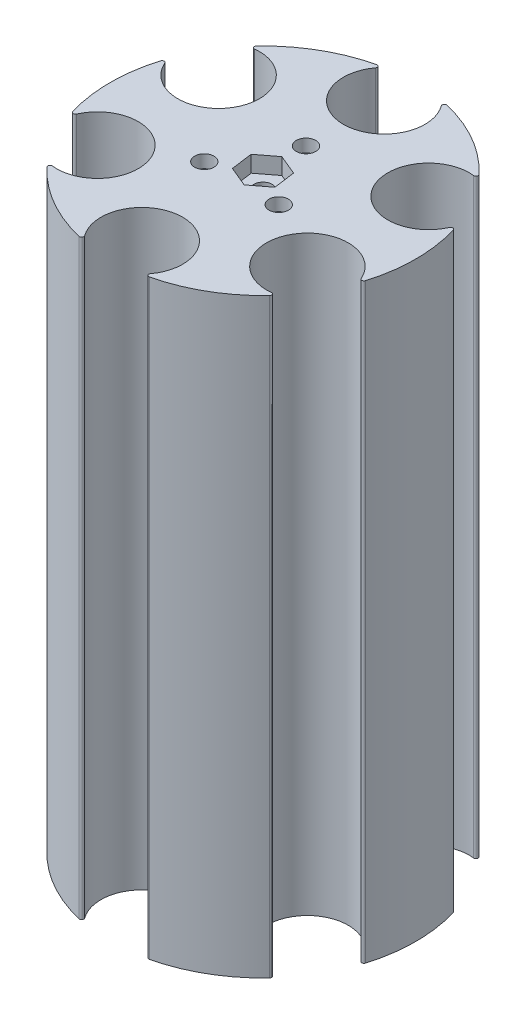
from build123d import *

# Parameters (mm, degrees)
SKETCH1_R               = 35.56
BOSS_EXTRUDE1_DEPTH     = 68.75
SKETCH2_R               = 9.5
CUT_EXTRUDE1_DEPTH      = 147.407913721
CIRPATTERN1_COUNT       = 6
SKETCH3_R               = 2.25
CUT_EXTRUDE2_DEPTH      = 3
CIRPATTERN2_COUNT       = 3
CUT_EXTRUDE3_DEPTH      = 3.81
SKETCH5_R               = 2.159
CUT_EXTRUDE4_DEPTH      = 7.62
MIRROR3_COPY_1_SKETCH_R = 2.25
MIRROR3_COPY_1_DEPTH    = 3
MIRROR3_COPY_2_SKETCH_R = 2.25
MIRROR3_COPY_2_DEPTH    = 3
FILLET1_R               = 0.5


with BuildPart() as part:
    # Sketch1 → Boss-Extrude1 (new, symmetric)
    with BuildSketch(Plane(origin=(0, 0, 0), x_dir=(1, 0, 0), z_dir=(0, 1, 0))):
        with Locations(Location((0, 0, 0), (0, 0, 270))):
            Circle(SKETCH1_R)
    extrude(amount=BOSS_EXTRUDE1_DEPTH, both=True)

    # Sketch2 → Cut-Extrude1 (cut, through all)
    with BuildSketch(Plane(origin=(0, 68.75, 0), x_dir=(1, 0, 0), z_dir=(0, 1, 0))):
        with Locations((0, 28.2)):
            Circle(SKETCH2_R)
    cut_extrude1 = extrude(amount=-CUT_EXTRUDE1_DEPTH, mode=Mode.SUBTRACT)

    # CirPattern1: Cut-Extrude1 ×6 about axis
    cirpattern1_axis = Axis((0, 0, 0), (0, 1, 0))
    for i in range(1, CIRPATTERN1_COUNT):
        add(cut_extrude1.rotate(cirpattern1_axis, i * 360 / CIRPATTERN1_COUNT), mode=Mode.SUBTRACT)

    # Sketch3 → Cut-Extrude2 (cut)
    with BuildSketch(Plane(origin=(0, 68.75, 0), x_dir=(1, 0, 0), z_dir=(0, 1, 0))):
        with Locations(Location((0, 10, 0), (0, 0, 270))):
            Circle(SKETCH3_R)
    cut_extrude2 = extrude(amount=-CUT_EXTRUDE2_DEPTH, mode=Mode.SUBTRACT)

    # CirPattern2: Cut-Extrude2 ×3 about axis
    cirpattern2_axis = Axis((0, 0, 0), (0, 1, 0))
    for i in range(1, CIRPATTERN2_COUNT):
        add(cut_extrude2.rotate(cirpattern2_axis, i * 360 / CIRPATTERN2_COUNT), mode=Mode.SUBTRACT)

    # Sketch4 → Cut-Extrude3 (cut)
    with BuildSketch(Plane(origin=(0, 68.75, 0), x_dir=(1, 0, 0), z_dir=(0, 1, 0))):
        Polygon((0.660730325, -5.037535982), (4.692999296, -1.946558744), (4.03226897, 3.090977238), (-0.660730325, 5.037535982), (-4.692999296, 1.946558744), (-4.03226897, -3.090977238), align=None)
    cut_extrude3 = extrude(amount=-CUT_EXTRUDE3_DEPTH, mode=Mode.SUBTRACT)

    # Sketch5 → Cut-Extrude4 (cut)
    with BuildSketch(Plane(origin=(0, 64.94, 0), x_dir=(1, 0, 0), z_dir=(0, 1, 0))):
        with Locations(Location((0, 0, 0), (0, 0, 270))):
            Circle(SKETCH5_R)
    cut_extrude4 = extrude(amount=-CUT_EXTRUDE4_DEPTH, mode=Mode.SUBTRACT)

    # Mirror3: Cut-Extrude2, Cut-Extrude3, Cut-Extrude4 across plane
    add(cut_extrude2.mirror(Plane.ZX), mode=Mode.SUBTRACT)
    add(cut_extrude3.mirror(Plane.ZX), mode=Mode.SUBTRACT)
    add(cut_extrude4.mirror(Plane.ZX), mode=Mode.SUBTRACT)

    # Mirror3 copy 1 sketch → Mirror3 copy 1 (cut)
    with BuildSketch(Plane(origin=(0, -68.75, 0), x_dir=(-0.4999999999999998, 0, -0.8660254037844387), z_dir=(0, -1, 0))):
        with Locations((0, -10)):
            Circle(MIRROR3_COPY_1_SKETCH_R)
    extrude(amount=-MIRROR3_COPY_1_DEPTH, mode=Mode.SUBTRACT)

    # Mirror3 copy 2 sketch → Mirror3 copy 2 (cut)
    with BuildSketch(Plane(origin=(0, -68.75, 0), x_dir=(-0.5000000000000004, 0, 0.8660254037844384), z_dir=(0, -1, 0))):
        with Locations((0, -10)):
            Circle(MIRROR3_COPY_2_SKETCH_R)
    extrude(amount=-MIRROR3_COPY_2_DEPTH, mode=Mode.SUBTRACT)

    # Fillet1
    fillet1_edges = [part.edges().sort_by_distance(p)[0] for p in [
        (33.599222194, 0, -11.644993256),
        (26.884471084, 0, -23.27528334),
        (26.884471084, 0, 23.27528334),
        (33.599222194, 0, 11.644993256),
        (-6.714751111, 0, 34.920276596),
        (6.714751111, 0, 34.920276596),
        (-33.599222194, 0, 11.644993256),
        (-26.884471084, 0, 23.27528334),
        (-26.884471084, 0, -23.27528334),
        (-33.599222194, 0, -11.644993256),
        (6.714751111, 0, -34.920276596),
        (-6.714751111, 0, -34.920276596),
    ]]
    fillet(fillet1_edges, radius=FILLET1_R)


solid = part.part
